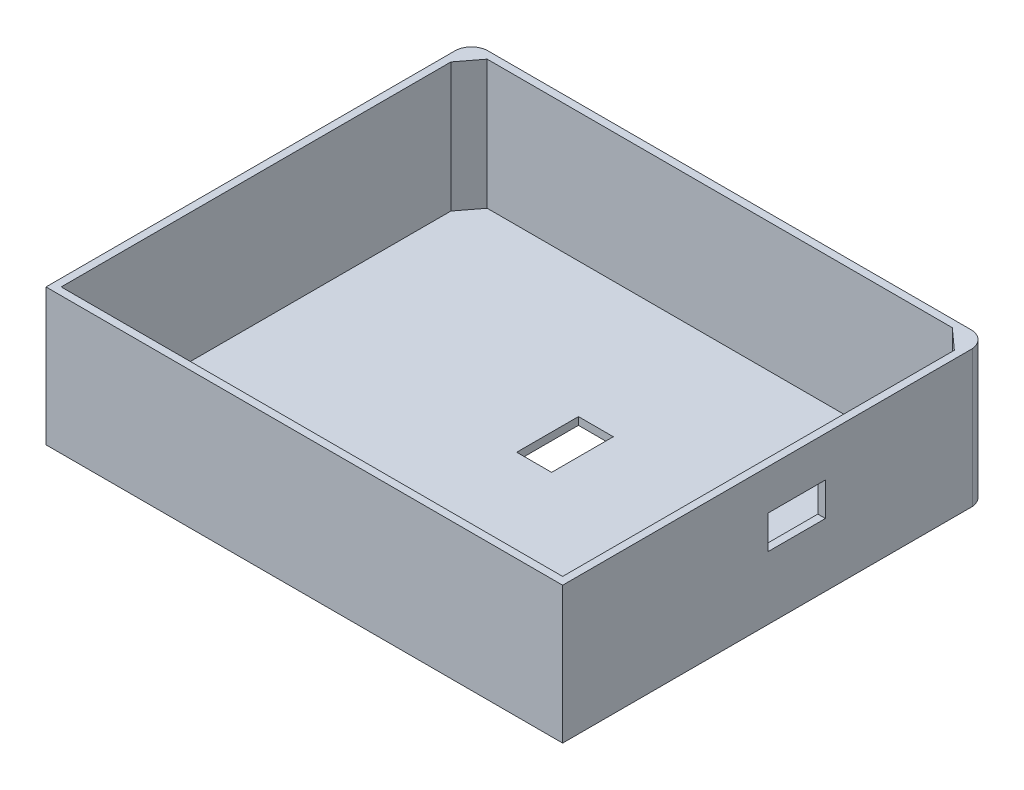
from build123d import *

# Parameters (mm, degrees)
SKETCH1_W           = 34
SKETCH1_H           = 28
BOSS_EXTRUDE1_DEPTH = 9
CUT_EXTRUDE1_DEPTH  = 8.5
CUT_EXTRUDE2_DEPTH  = 9
CUT_EXTRUDE3_DEPTH  = 9
SKETCH6_W           = 2.295965215
SKETCH6_H           = 4.061171394
CUT_EXTRUDE4_DEPTH  = 9
SKETCH7_W           = 3.765813474
SKETCH7_H           = 2.196724527
CUT_EXTRUDE5_DEPTH  = 9


with BuildPart() as part:
    # Sketch1 → Boss-Extrude1 (new body)
    with BuildSketch(Plane(origin=(0, 0, 0), x_dir=(1, 0, 0), z_dir=(0, 1, 0))):
        with Locations((1.757158316, -7.233665399)):
            Rectangle(SKETCH1_W, SKETCH1_H)
    extrude(amount=BOSS_EXTRUDE1_DEPTH)

    # Sketch3 → Cut-Extrude1 (cut)
    with BuildSketch(Plane(origin=(0, 9, 0), x_dir=(1, 0, 0), z_dir=(0, 1, 0))):
        Polygon((-13.709642768, 6.266334601), (-14.742841684, 4.916334601), (-14.742841684, -17.206480141), (-14.742841684, -20.733665399), (18.257158316, -20.733665399), (18.257158316, 5.046334601), (16.903908894, 6.266334601), align=None)
    extrude(amount=-CUT_EXTRUDE1_DEPTH, mode=Mode.SUBTRACT)

    # Sketch4 → Cut-Extrude2 (cut)
    with BuildSketch(Plane(origin=(0, 9, 0), x_dir=(1, 0, 0), z_dir=(0, 1, 0))):
        with BuildLine():
            Line((-15.242841684, 5.703653574), (-15.242841684, 6.766334601))
            Line((-15.242841684, 6.766334601), (-14.184858911, 6.765079364))
            ThreePointArc((-14.184858911, 6.765079364), (-14.926543667, 6.446369911), (-15.242841684, 5.703653574))
        make_face()
        with BuildLine():
            Line((18.763393814, 5.6549421), (18.757158316, 6.766334601))
            Line((18.757158316, 6.766334601), (17.66754215, 6.766334601))
            ThreePointArc((17.66754215, 6.766334601), (18.434091592, 6.4262049), (18.763393814, 5.6549421))
        make_face()
    extrude(amount=-CUT_EXTRUDE2_DEPTH, mode=Mode.SUBTRACT)

    # Sketch5 → Cut-Extrude3 (cut)
    with BuildSketch(Plane(origin=(0, 9, 0), x_dir=(1, 0, 0), z_dir=(0, 1, 0))):
        Polygon((-14.184858911, 6.765079364), (-14.181243432, 6.766334601), (-15.374291847, 6.820902747), (-15.330265958, 6.661105077), align=None)
    extrude(amount=-CUT_EXTRUDE3_DEPTH, mode=Mode.SUBTRACT)

    # Sketch6 → Cut-Extrude4 (cut)
    with BuildSketch(Plane(origin=(0, 0.5, 0), x_dir=(1, 0, 0), z_dir=(0, 1, 0))):
        with Locations((2.314867695, -4.634515707)):
            Rectangle(SKETCH6_W, SKETCH6_H)
    extrude(amount=-CUT_EXTRUDE4_DEPTH, mode=Mode.SUBTRACT)

    # Sketch7 → Cut-Extrude5 (cut)
    with BuildSketch(Plane(origin=(18.757158316, 0, 0), x_dir=(0, 0, -1), z_dir=(1, 0, 0))):
        with Locations((-5.821485346, 5.253162695)):
            Rectangle(SKETCH7_W, SKETCH7_H)
    extrude(amount=-CUT_EXTRUDE5_DEPTH, mode=Mode.SUBTRACT)


solid = part.part
